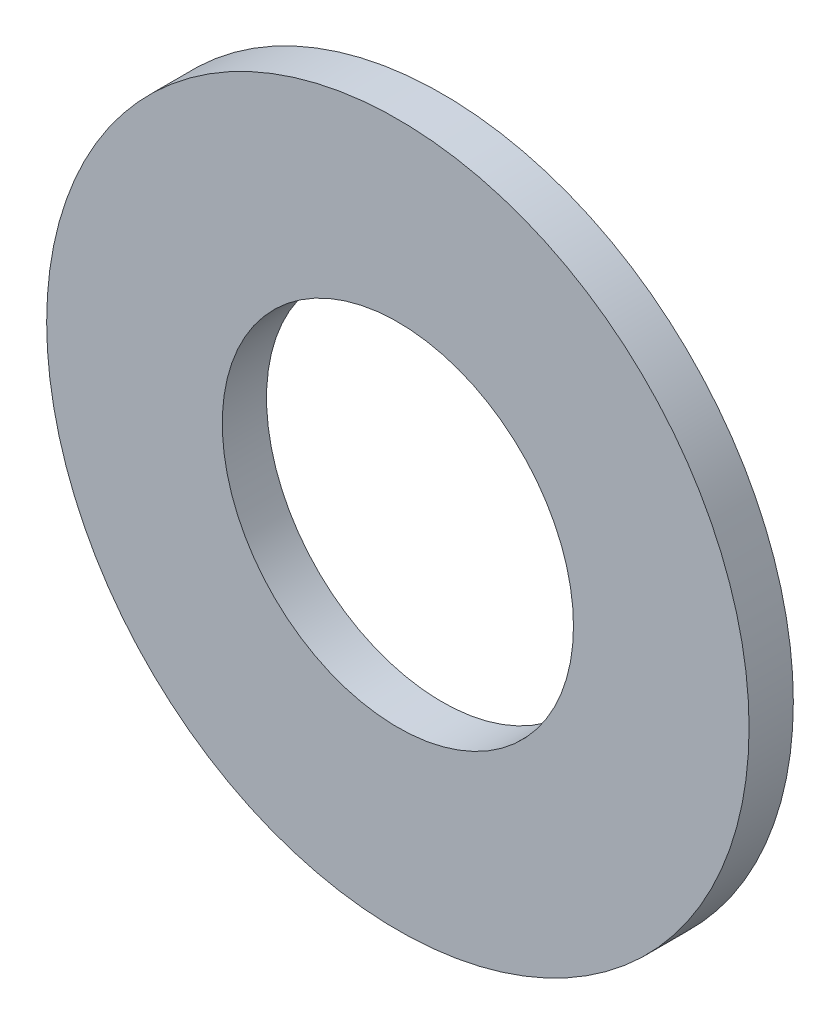
from build123d import *

# Parameters (mm, degrees)
SKETCH1_R           = 12.7
SKETCH1_R_2         = 6.35
BOSS_EXTRUDE1_DEPTH = 1.6002


with BuildPart() as part:
    # Sketch1 → Boss-Extrude1 (new body)
    with BuildSketch(Plane.XY):
        Circle(SKETCH1_R)
        Circle(SKETCH1_R_2, mode=Mode.SUBTRACT)
    extrude(amount=BOSS_EXTRUDE1_DEPTH)


solid = part.part
